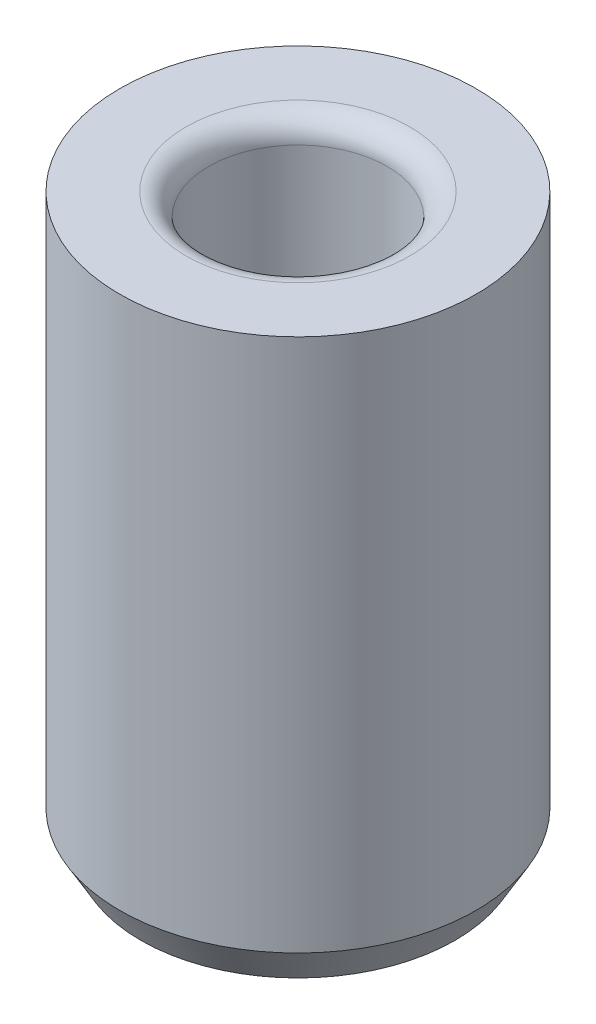
from build123d import *

# Parameters (mm, degrees)
CHAMFER1_SIZE  = 0.8128
CHAMFER1_SIZE2 = 0.469270299


with BuildPart() as part:
    # Sketch1 → BODY (revolve)
    with BuildSketch(Plane.XY, mode=Mode.PRIVATE) as body_sk:
        with BuildLine():
            Line((2.492375, 0), (3.96875, 0))
            Line((3.96875, 0), (3.96875, -12.7))
            Line((3.96875, -12.7), (2.365375, -12.7))
            Line((2.365375, -12.7), (1.984375, -12.319))
            Line((1.984375, -12.319), (1.984375, -0.508))
            ThreePointArc((1.984375, -0.508), (2.133164755, -0.148789755), (2.492375, 0))
        make_face()
    revolve(body_sk.sketch.rotate(Axis((0, 0, 0), (0, -1, 0)), 180), axis=Axis((0, 0, 0), (0, -1, 0)))

    # Chamfer1
    chamfer1_edges = [part.edges().sort_by_distance(p)[0] for p in [
        (3.96875, -12.7, 0),
    ]]
    chamfer1_side = [part.faces().sort_by_distance(p)[0] for p in [
        (3.96875, -6.35, 0),
    ]]
    chamfer(chamfer1_edges, length=CHAMFER1_SIZE, length2=CHAMFER1_SIZE2, reference=chamfer1_side[0])


solid = part.part
